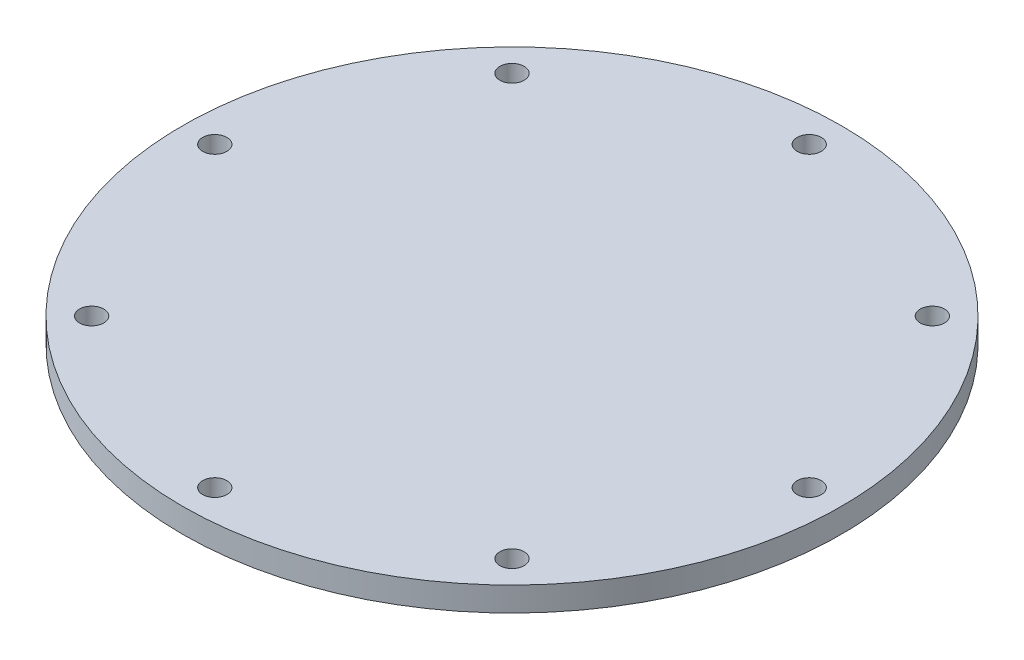
from build123d import *

# Parameters (mm, degrees)
SKETCH_1_R      = 40.769552622
SKETCH_1_R_2    = 1.5
EXTRUDE_1_DEPTH = 3


with BuildPart() as part:
    # 草图1 → 凸台-拉伸1 (new body)
    with BuildSketch(Plane(origin=(0, 0, 0), x_dir=(1, 0, 0), z_dir=(0, 1, 0))):
        with Locations(Location((0, 0, 0), (0, 0, 270))):
            Circle(SKETCH_1_R)
        with Locations(Location((-26, 26, 0), (0, 0, 270))):
            Circle(SKETCH_1_R_2, mode=Mode.SUBTRACT)
        with Locations(Location((26, 26, 0), (0, 0, 270))):
            Circle(SKETCH_1_R_2, mode=Mode.SUBTRACT)
        with Locations(Location((26, -26, 0), (0, 0, 270))):
            Circle(SKETCH_1_R_2, mode=Mode.SUBTRACT)
        with Locations(Location((-26, -26, 0), (0, 0, 270))):
            Circle(SKETCH_1_R_2, mode=Mode.SUBTRACT)
        with Locations(Location((0, 36.769552622, 0), (0, 0, 270))):
            Circle(SKETCH_1_R_2, mode=Mode.SUBTRACT)
        with Locations(Location((36.769552622, 0, 0), (0, 0, 270))):
            Circle(SKETCH_1_R_2, mode=Mode.SUBTRACT)
        with Locations(Location((0, -36.769552622, 0), (0, 0, 270))):
            Circle(SKETCH_1_R_2, mode=Mode.SUBTRACT)
        with Locations(Location((-36.769552622, 0, 0), (0, 0, 270))):
            Circle(SKETCH_1_R_2, mode=Mode.SUBTRACT)
    extrude(amount=EXTRUDE_1_DEPTH)


solid = part.part
